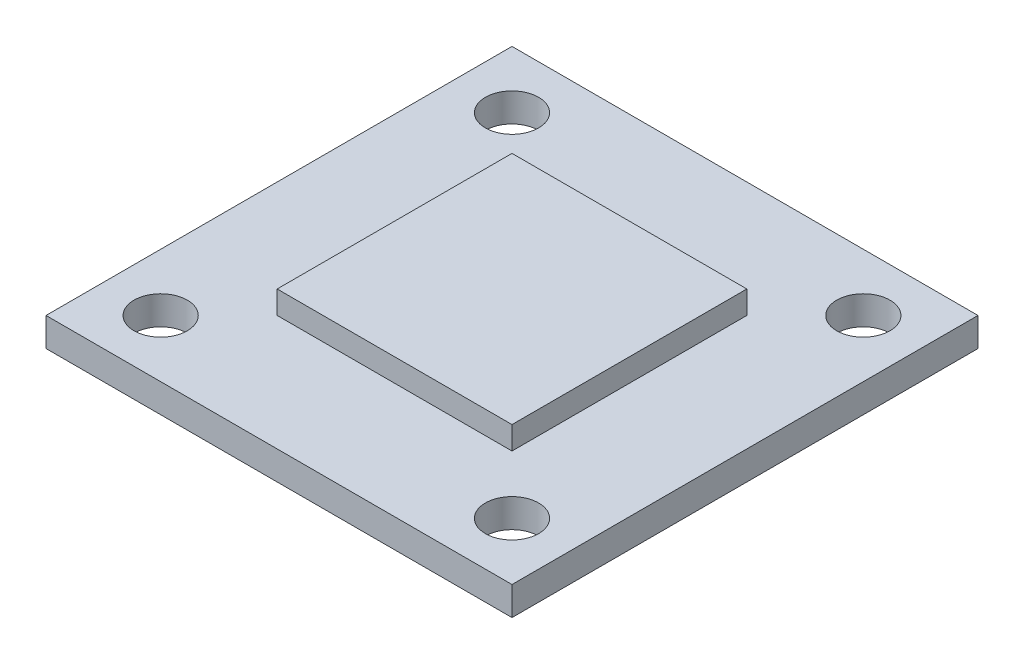
from build123d import *

# Parameters (mm, degrees)
SKETCH1_W                   = 25.8064
SKETCH1_H                   = 25.8064
BOSS_EXTRUDE1_DEPTH         = 1.5875
SKETCH2_W                   = 13.0048
SKETCH2_H                   = 13.0048
BOSS_EXTRUDE2_DEPTH         = 1.27
F_32_0_116_DIAMETER_HOLE1_D = 2.9464


with BuildPart() as part:
    # Sketch1 → Boss-Extrude1 (new body)
    with BuildSketch(Plane(origin=(0, 0, 0), x_dir=(1, 0, 0), z_dir=(0, 1, 0))):
        Rectangle(SKETCH1_W, SKETCH1_H)
    extrude(amount=BOSS_EXTRUDE1_DEPTH)

    # Sketch2 → Boss-Extrude2 (add)
    with BuildSketch(Plane(origin=(0, 1.5875, 0), x_dir=(1, 0, 0), z_dir=(0, 1, 0))):
        Rectangle(SKETCH2_W, SKETCH2_H)
    extrude(amount=BOSS_EXTRUDE2_DEPTH)

    # #32 (0.116) Diameter Hole1 (through all)
    with Locations(Plane(origin=(-9.7282, 1.5875, -9.7282), x_dir=(0, 0, 1), z_dir=(0, 1, 0))):
        with Locations((0, 0), (19.4564, 0), (19.4564, 19.4564), (0, 19.4564)):
            Hole(F_32_0_116_DIAMETER_HOLE1_D / 2)


solid = part.part
